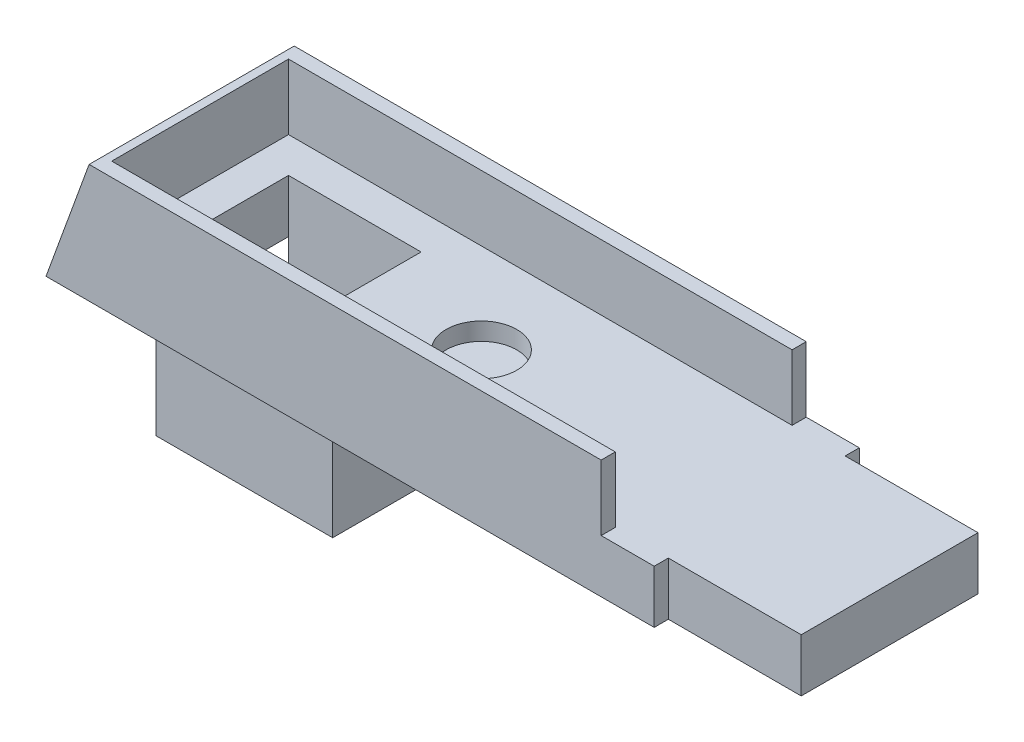
from build123d import *

# Parameters (mm, degrees)
SKETCH_1_W          = 7.5
SKETCH_1_H          = 6
EXTRUDE_1_DEPTH     = 3
EXTRUDE_2_DEPTH     = 6
SKETCH_3_R          = 2
CUT_EXTRUDE_1_DEPTH = 1
EXTRUDE_3_DEPTH     = 3.7
EXTRUDE_4_DEPTH     = 11.6
CUT_EXTRUDE_2_DEPTH = 12


with BuildPart() as part:
    # 草图1 → 凸台-拉伸1 (new body)
    with BuildSketch(Plane(origin=(0, 0, 0), x_dir=(1, 0, 0), z_dir=(0, 1, 0))):
        Polygon((23.991089217, -4.397070764), (23.991089217, -14.397070764), (16.47582205, -14.397070764), (16.47582205, -15.197070764), (2.97582205, -15.197070764), (-4.02417795, -15.197070764), (-16.008910783, -15.197070764), (-16.008910783, -3.597070764), (-4.02417795, -3.597070764), (2.97582205, -3.597070764), (16.47582205, -3.597070764), (16.47582205, -4.397070764), align=None)
        with Locations((-9.258910783, -9.397070764)):
            Rectangle(SKETCH_1_W, SKETCH_1_H, mode=Mode.SUBTRACT)
    extrude(amount=EXTRUDE_1_DEPTH)

    # 草图2 → 凸台-拉伸2 (add)
    with BuildSketch(Plane.XZ):
        Polygon((-13.008910783, 12.397070764), (-13.008910783, 13.897070764), (-3.008910783, 13.897070764), (-3.008910783, 4.897070764), (-13.008910783, 4.897070764), (-13.008910783, 6.397070764), (-5.508910783, 6.397070764), (-5.508910783, 12.397070764), align=None)
    extrude(amount=EXTRUDE_2_DEPTH)

    # 草图3 → 切除-拉伸1 (cut)
    with BuildSketch(Plane(origin=(0, 3, 0), x_dir=(1, 0, 0), z_dir=(0, 1, 0))):
        with Locations(Location((0.991089217, -9.484524381, 0), (0, 0, 270))):
            Circle(SKETCH_3_R)
    extrude(amount=-CUT_EXTRUDE_1_DEPTH, mode=Mode.SUBTRACT)

    # 草图4 → 凸台-拉伸3 (add)
    with BuildSketch(Plane(origin=(0, 3, 0), x_dir=(1, 0, 0), z_dir=(0, 1, 0))):
        Polygon((-16.008910783, -3.597070764), (13.47582205, -3.597070764), (13.47582205, -4.397070764), (-15.008910783, -4.397070764), (-15.008910783, -14.397070764), (13.47582205, -14.397070764), (13.47582205, -15.197070764), (-16.008910783, -15.197070764), align=None)
    extrude(amount=EXTRUDE_3_DEPTH)

    # 草图7 → 凸台-拉伸4 (add)
    with BuildSketch(Plane.XY.offset(15.197070764)):
        Polygon((-16.008910783, 0), (-16.008910783, 6.7), (-18.447511353, 0), align=None)
    extrude(amount=-EXTRUDE_4_DEPTH)

    # 草图8 → 切除-拉伸2 (cut)
    with BuildSketch(Plane.XY.offset(15.197070764)):
        Polygon((-16.008910783, 6.7), (-18.447511353, 0), (-17.926064244, 0), (-15.487463675, 6.7), align=None)
    extrude(amount=-CUT_EXTRUDE_2_DEPTH, mode=Mode.SUBTRACT)


solid = part.part
